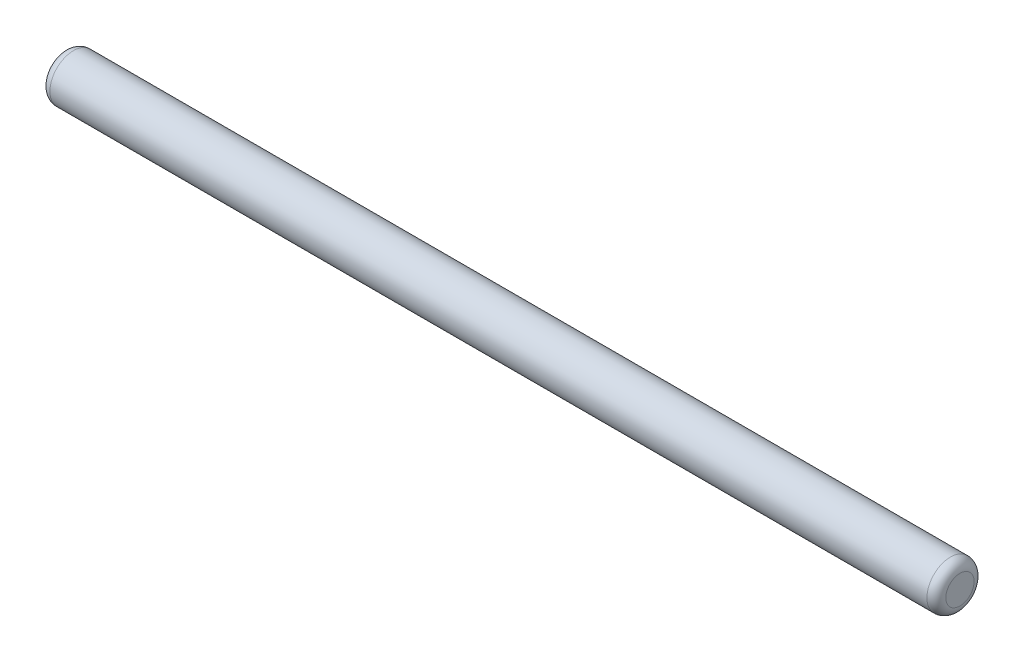
from build123d import *

# Parameters (mm, degrees)
SKETCH1_R           = 3.175
BOSS_EXTRUDE1_DEPTH = 120.65
FILLET1_R           = 1.27


with BuildPart() as part:
    # Sketch1 → Boss-Extrude1 (new body)
    with BuildSketch(Plane(origin=(0, 0, 0), x_dir=(0, 0, -1), z_dir=(1, 0, 0))):
        with Locations(Location((0, 0, 0), (0, 0, 180))):
            Circle(SKETCH1_R)
    extrude(amount=BOSS_EXTRUDE1_DEPTH)

    # Fillet1
    fillet1_edges = [part.edges().sort_by_distance(p)[0] for p in [
        (0, 0, -3.175),
        (120.65, 0, -3.175),
    ]]
    fillet(fillet1_edges, radius=FILLET1_R)


solid = part.part
